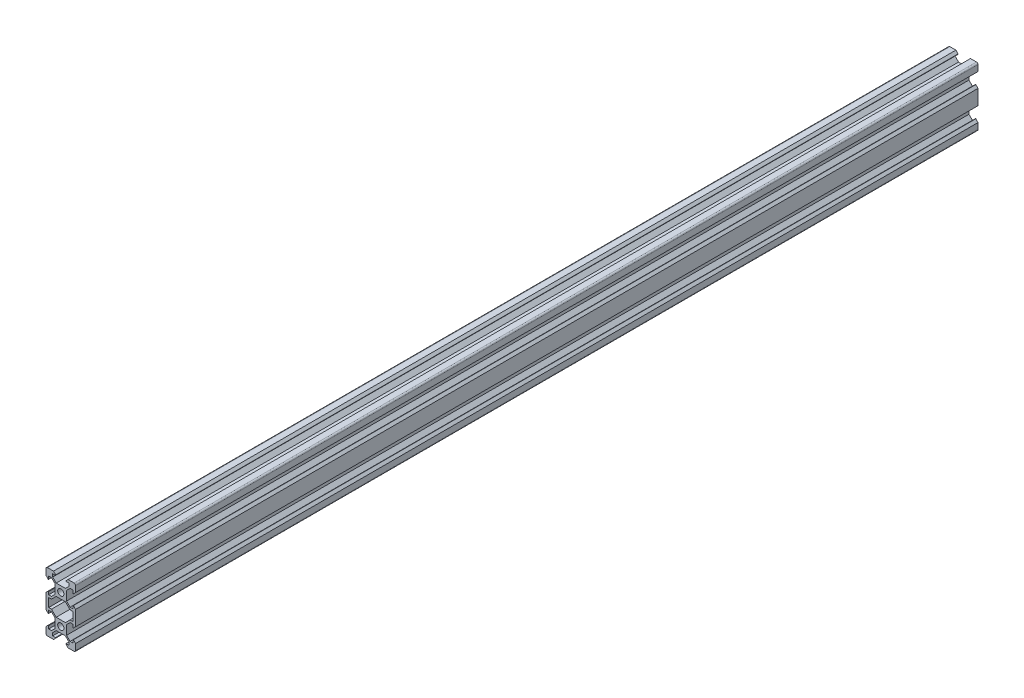
from build123d import *

# Parameters (mm, degrees)
SKETCH11_R             = 2.1
VSLOT2040_2040_1_DEPTH = 609.6


with BuildPart() as part:
    # Sketch11 → Vslot2040 2040(1) (new body)
    with BuildSketch(Plane(origin=(0, 0, 304.8), x_dir=(-1, 0, 0), z_dir=(0, 0, -1))):
        with BuildLine():
            Line((5.5, -18.2), (3.607842712, -18.2))
            ThreePointArc((3.607842712, -18.2), (3.423066806, -18.323463314), (3.466421356, -18.541421356))
            Line((3.466421356, -18.541421356), (4.925, -20))
            Line((4.925, -20), (9, -20))
            ThreePointArc((9, -20), (9.707106781, -19.707106781), (10, -19))
            Line((10, -19), (10, -14.925))
            Line((10, -14.925), (8.541421356, -13.466421356))
            ThreePointArc((8.541421356, -13.466421356), (8.323463314, -13.423066806), (8.2, -13.607842712))
            Line((8.2, -13.607842712), (8.2, -15.5))
            Line((8.2, -15.5), (6.275, -15.5))
            Line((6.275, -15.5), (3.9, -13.125))
            Line((3.9, -13.125), (3.9, -6.875))
            Line((3.9, -6.875), (6.275, -4.5))
            Line((6.275, -4.5), (8.2, -4.5))
            Line((8.2, -4.5), (8.2, -6.392157288))
            ThreePointArc((8.2, -6.392157288), (8.323463314, -6.576933194), (8.541421356, -6.533578644))
            Line((8.541421356, -6.533578644), (10, -5.075))
            Line((10, -5.075), (10, 5.075))
            Line((10, 5.075), (8.541421356, 6.533578644))
            ThreePointArc((8.541421356, 6.533578644), (8.323463314, 6.576933194), (8.2, 6.392157288))
            Line((8.2, 6.392157288), (8.2, 4.5))
            Line((8.2, 4.5), (6.275, 4.5))
            Line((6.275, 4.5), (3.9, 6.875))
            Line((3.9, 6.875), (3.9, 13.125))
            Line((3.9, 13.125), (6.275, 15.5))
            Line((6.275, 15.5), (8.2, 15.5))
            Line((8.2, 15.5), (8.2, 13.607842712))
            ThreePointArc((8.2, 13.607842712), (8.323463314, 13.423066806), (8.541421356, 13.466421356))
            Line((8.541421356, 13.466421356), (10, 14.925))
            Line((10, 14.925), (10, 19))
            ThreePointArc((10, 19), (9.707106781, 19.707106781), (9, 20))
            Line((9, 20), (4.925, 20))
            Line((4.925, 20), (3.466421356, 18.541421356))
            ThreePointArc((3.466421356, 18.541421356), (3.423066806, 18.323463314), (3.607842712, 18.2))
            Line((3.607842712, 18.2), (5.5, 18.2))
            Line((5.5, 18.2), (5.5, 16.275))
            Line((5.5, 16.275), (3.125, 13.9))
            Line((3.125, 13.9), (-3.125, 13.9))
            Line((-3.125, 13.9), (-5.5, 16.275))
            Line((-5.5, 16.275), (-5.5, 18.2))
            Line((-5.5, 18.2), (-3.607842712, 18.2))
            ThreePointArc((-3.607842712, 18.2), (-3.423066806, 18.323463314), (-3.466421356, 18.541421356))
            Line((-3.466421356, 18.541421356), (-4.925, 20))
            Line((-4.925, 20), (-9, 20))
            ThreePointArc((-9, 20), (-9.707106781, 19.707106781), (-10, 19))
            Line((-10, 19), (-10, 14.925))
            Line((-10, 14.925), (-8.541421356, 13.466421356))
            ThreePointArc((-8.541421356, 13.466421356), (-8.323463314, 13.423066806), (-8.2, 13.607842712))
            Line((-8.2, 13.607842712), (-8.2, 15.5))
            Line((-8.2, 15.5), (-6.275, 15.5))
            Line((-6.275, 15.5), (-3.9, 13.125))
            Line((-3.9, 13.125), (-3.9, 6.875))
            Line((-3.9, 6.875), (-6.275, 4.5))
            Line((-6.275, 4.5), (-8.2, 4.5))
            Line((-8.2, 4.5), (-8.2, 6.392157288))
            ThreePointArc((-8.2, 6.392157288), (-8.323463314, 6.576933194), (-8.541421356, 6.533578644))
            Line((-8.541421356, 6.533578644), (-10, 5.075))
            Line((-10, 5.075), (-10, -5.075))
            Line((-10, -5.075), (-8.541421356, -6.533578644))
            ThreePointArc((-8.541421356, -6.533578644), (-8.323463314, -6.576933194), (-8.2, -6.392157288))
            Line((-8.2, -6.392157288), (-8.2, -4.5))
            Line((-8.2, -4.5), (-6.275, -4.5))
            Line((-6.275, -4.5), (-3.9, -6.875))
            Line((-3.9, -6.875), (-3.9, -13.125))
            Line((-3.9, -13.125), (-6.275, -15.5))
            Line((-6.275, -15.5), (-8.2, -15.5))
            Line((-8.2, -15.5), (-8.2, -13.607842712))
            ThreePointArc((-8.2, -13.607842712), (-8.323463314, -13.423066806), (-8.541421356, -13.466421356))
            Line((-8.541421356, -13.466421356), (-10, -14.925))
            Line((-10, -14.925), (-10, -19))
            ThreePointArc((-10, -19), (-9.707106781, -19.707106781), (-9, -20))
            Line((-9, -20), (-4.925, -20))
            Line((-4.925, -20), (-3.466421356, -18.541421356))
            ThreePointArc((-3.466421356, -18.541421356), (-3.423066806, -18.323463314), (-3.607842712, -18.2))
            Line((-3.607842712, -18.2), (-5.5, -18.2))
            Line((-5.5, -18.2), (-5.5, -16.275))
            Line((-5.5, -16.275), (-3.125, -13.9))
            Line((-3.125, -13.9), (3.125, -13.9))
            Line((3.125, -13.9), (5.5, -16.275))
            Line((5.5, -16.275), (5.5, -18.2))
        make_face()
        with Locations((0, -10)):
            Circle(SKETCH11_R, mode=Mode.SUBTRACT)
        with Locations((0, 10)):
            Circle(SKETCH11_R, mode=Mode.SUBTRACT)
        Polygon((3.125, 6.1), (6.275, 2.95), (8.2, 2.95), (8.2, -2.95), (6.275, -2.95), (3.125, -6.1), (-3.125, -6.1), (-6.275, -2.95), (-8.2, -2.95), (-8.2, 2.95), (-6.275, 2.95), (-3.125, 6.1), align=None, mode=Mode.SUBTRACT)
    extrude(amount=VSLOT2040_2040_1_DEPTH)


solid = part.part
